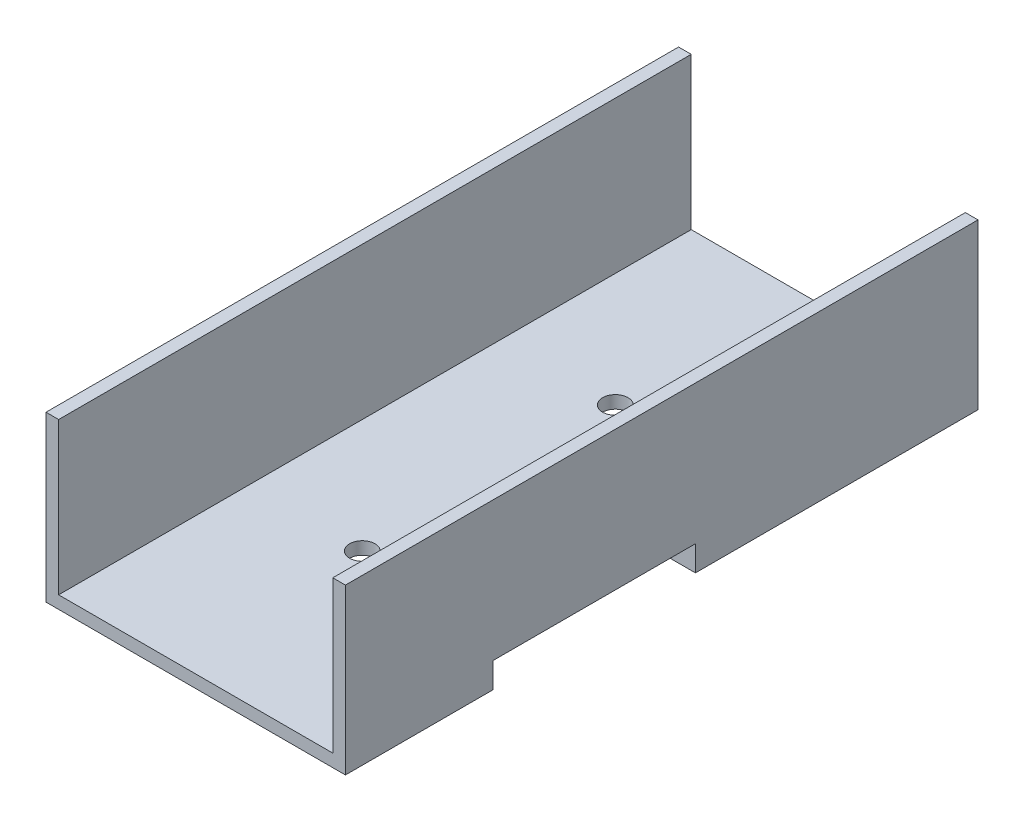
from build123d import *

# Parameters (mm, degrees)
EXTRU_MINCE1_DEPTH      = 37.5
ESQUISSE2_R             = 1.5
ENL_V_MAT_EXTRU_1_DEPTH = 3


with BuildPart() as part:
    # Esquisse1 → Extru.-Mince1 (new, symmetric)
    with BuildSketch(Plane.XY):
        Polygon((-17.75, 19.5), (-17.75, 0), (17.75, 0), (17.75, 19.5), (16.25, 19.5), (16.25, 1.5), (-16.25, 1.5), (-16.25, 19.5), align=None)
    extrude(amount=EXTRU_MINCE1_DEPTH, both=True)

    # Esquisse2 → Enlèv. mat.-Extru.1 (cut)
    with BuildSketch(Plane.XZ):
        with Locations(Location((-2.75, 15, 0), (0, 0, 270))):
            Circle(ESQUISSE2_R)
        with Locations(Location((-2.75, -15, 0), (0, 0, 90))):
            Circle(ESQUISSE2_R)
        with BuildLine():
            Line((11.75, 20), (17.75, 20))
            Line((17.75, 20), (17.75, -4))
            Line((17.75, -4), (11.75, -4))
            ThreePointArc((11.75, -4), (8.921572875, -2.828427125), (7.75, 0))
            Line((7.75, 0), (7.75, 16))
            ThreePointArc((7.75, 16), (8.921572875, 18.828427125), (11.75, 20))
        make_face()
    extrude(amount=-ENL_V_MAT_EXTRU_1_DEPTH, mode=Mode.SUBTRACT)


solid = part.part
